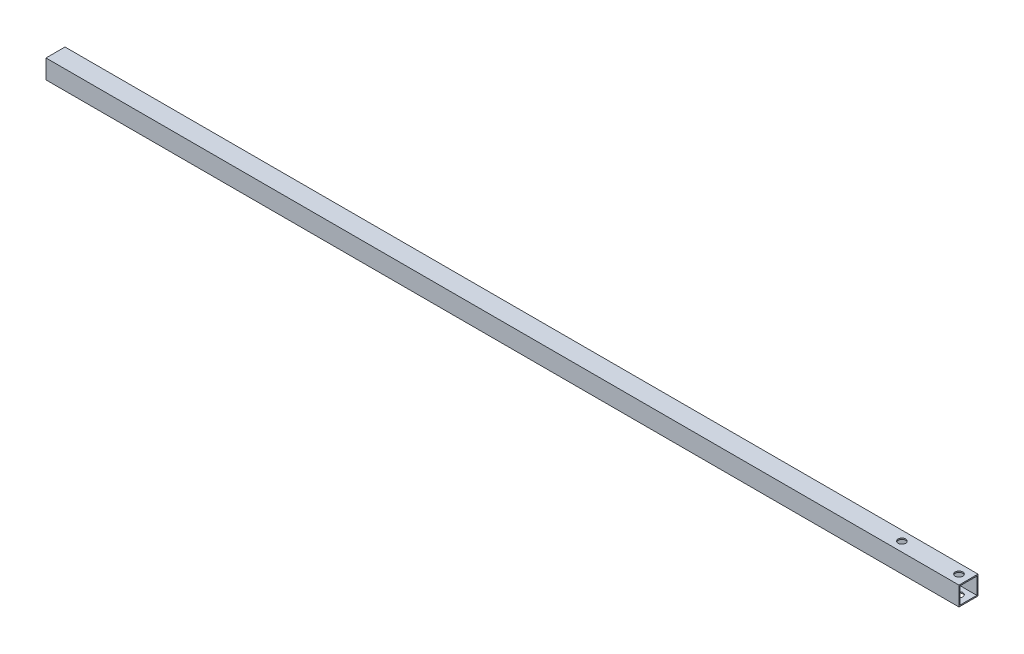
from build123d import *

# Parameters (mm, degrees)
SKETCH1_W               = 25.4
SKETCH1_H               = 25.4
SKETCH1_W_2             = 22.225
SKETCH1_H_2             = 22.225
BOSS_EXTRUDE1_DEPTH     = 1219.2
F_3_8_CLEARANCE_HOLE1_D = 10.0838


with BuildPart() as part:
    # Sketch1 → Boss-Extrude1 (new body)
    with BuildSketch(Plane(origin=(0, 0, 0), x_dir=(0, 0, -1), z_dir=(1, 0, 0))):
        Rectangle(SKETCH1_W, SKETCH1_H)
        Rectangle(SKETCH1_W_2, SKETCH1_H_2, mode=Mode.SUBTRACT)
    extrude(amount=BOSS_EXTRUDE1_DEPTH)

    # 3/8 Clearance Hole1 (through all)
    with Locations(Plane(origin=(0, 12.7, 0), x_dir=(1, 0, 0), z_dir=(0, 1, 0))):
        with Locations((1206.5, 0), (1130.3, 0)):
            Hole(F_3_8_CLEARANCE_HOLE1_D / 2)


solid = part.part
